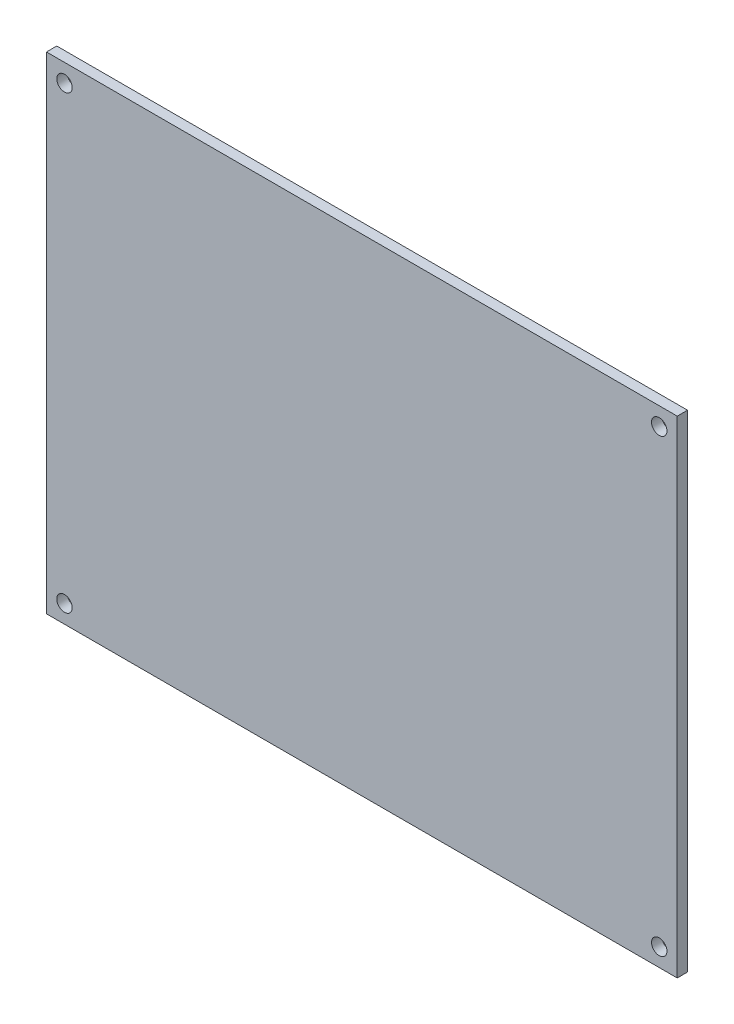
from build123d import *

# Parameters (mm, degrees)
SKETCH2_W           = 122.5
SKETCH2_H           = 94.5
SKETCH2_R           = 1.5
BOSS_EXTRUDE1_DEPTH = 2


with BuildPart() as part:
    # Sketch2 → Boss-Extrude1 (new body)
    with BuildSketch(Plane.XY):
        Rectangle(SKETCH2_W, SKETCH2_H)
        with Locations((-57.75, 43.75)):
            Circle(SKETCH2_R, mode=Mode.SUBTRACT)
        with Locations((-57.75, -43.75)):
            Circle(SKETCH2_R, mode=Mode.SUBTRACT)
        with Locations((57.75, 43.75)):
            Circle(SKETCH2_R, mode=Mode.SUBTRACT)
        with Locations((57.75, -43.75)):
            Circle(SKETCH2_R, mode=Mode.SUBTRACT)
    extrude(amount=BOSS_EXTRUDE1_DEPTH)


solid = part.part
